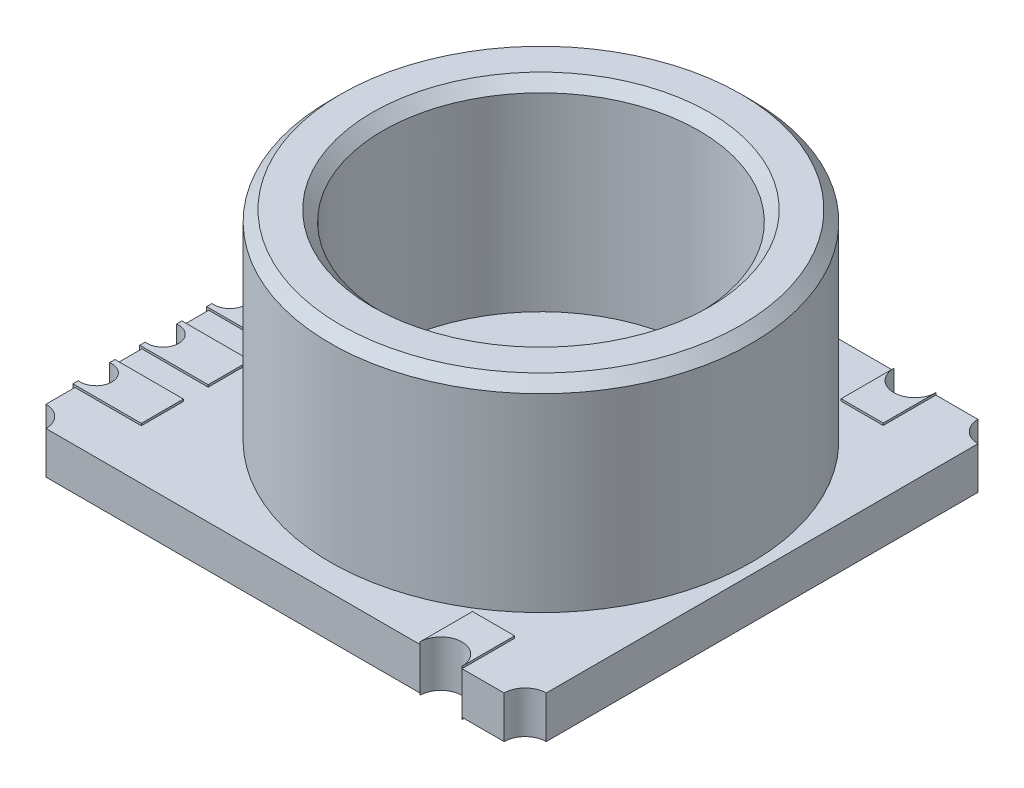
from build123d import *

# Parameters (mm, degrees)
SKETCH_1_W               = 9.5
SKETCH_1_H               = 9
EXTRUDE_1_DEPTH          = 0.8
SKETCH_4_R               = 0.4
CUT_EXTRUDE_1_DEPTH      = 7.59185103
EXTRUDE_2_DEPTH          = 0.04
EXTRUDE_2_DEPTH_BACK     = 0.84
SKETCH_6_W               = 1.3
SKETCH_6_H               = 0.8
SKETCH_6_W_2             = 0.8
SKETCH_6_H_2             = 1
CUT_EXTRUDE_2_DEPTH      = 7.62568487
CUT_EXTRUDE_2_DEPTH_BACK = 7.62568487
SKETCH_5_R               = 0.4
SKETCH_5_R_2             = 0.3
SKETCH_7_R               = 4
SKETCH_7_R_2             = 3
EXTRUDE_3_DEPTH          = 3.8
CHAMFER_1_SIZE           = 0.2
CHAMFER_2_SIZE           = 0.2


with BuildPart() as part:
    # Эскиз1 → Бобышка-Вытянуть1 (new body)
    with BuildSketch(Plane(origin=(0, 0, 0), x_dir=(1, 0, 0), z_dir=(0, 1, 0))):
        Rectangle(SKETCH_1_W, SKETCH_1_H)
    extrude(amount=EXTRUDE_1_DEPTH)

    # Эскиз4 → Вырез-Вытянуть1 (cut, through all)
    with BuildSketch(Plane.XZ):
        with Locations((-4.75, -4.5)):
            Circle(SKETCH_4_R)
        with Locations((4.75, -4.5)):
            Circle(SKETCH_4_R)
        with Locations((-4.75, 4.5)):
            Circle(SKETCH_4_R)
        with Locations((4.75, 4.5)):
            Circle(SKETCH_4_R)
    extrude(amount=-CUT_EXTRUDE_1_DEPTH, mode=Mode.SUBTRACT)

    # Эскиз6 → Бобышка-Вытянуть2 (add, two sides: drawn at the far end of the back side and taken through both)
    with BuildSketch(Plane(origin=(0, 0.8, 0), x_dir=(1, 0, 0), z_dir=(0, 1, 0)).offset(-EXTRUDE_2_DEPTH_BACK)):
        with Locations((-4.14, 3.2)):
            Rectangle(SKETCH_6_W, SKETCH_6_H)
        with Locations((-4.14, 1.93)):
            Rectangle(SKETCH_6_W, SKETCH_6_H)
        with Locations((-4.14, 0.66)):
            Rectangle(SKETCH_6_W, SKETCH_6_H)
        with Locations((-4.14, -0.61)):
            Rectangle(SKETCH_6_W, SKETCH_6_H)
        with Locations((-4.14, -1.88)):
            Rectangle(SKETCH_6_W, SKETCH_6_H)
        with Locations((-4.14, -3.15)):
            Rectangle(SKETCH_6_W, SKETCH_6_H)
        with Locations((3.15, 4)):
            Rectangle(SKETCH_6_W_2, SKETCH_6_H_2)
        with Locations((3.15, -4)):
            Rectangle(SKETCH_6_W_2, SKETCH_6_H_2)
    extrude(amount=EXTRUDE_2_DEPTH + EXTRUDE_2_DEPTH_BACK)

    # Эскиз5 → Вырез-Вытянуть2 (cut, two sides: drawn at the far end of the back side and taken through both)
    with BuildSketch(Plane.XZ.offset(-CUT_EXTRUDE_2_DEPTH_BACK)):
        with Locations((3.15, 4.5)):
            Circle(SKETCH_5_R)
        with Locations((3.15, -4.5)):
            Circle(SKETCH_5_R)
        with Locations((-4.75, -3.2)):
            Circle(SKETCH_5_R_2)
        with Locations((-4.75, -1.93)):
            Circle(SKETCH_5_R_2)
        with Locations((-4.75, -0.66)):
            Circle(SKETCH_5_R_2)
        with Locations((-4.75, 0.61)):
            Circle(SKETCH_5_R_2)
        with Locations((-4.75, 1.88)):
            Circle(SKETCH_5_R_2)
        with Locations((-4.75, 3.15)):
            Circle(SKETCH_5_R_2)
    extrude(amount=CUT_EXTRUDE_2_DEPTH + CUT_EXTRUDE_2_DEPTH_BACK, mode=Mode.SUBTRACT)

    # Эскиз7 → Бобышка-Вытянуть3 (add)
    with BuildSketch(Plane(origin=(0, 0.8, 0), x_dir=(1, 0, 0), z_dir=(0, 1, 0))):
        with Locations(Location((0.55, 0, 0), (0, 0, 90))):
            Circle(SKETCH_7_R)
        with Locations(Location((0.55, 0, 0), (0, 0, 90))):
            Circle(SKETCH_7_R_2, mode=Mode.SUBTRACT)
    extrude(amount=EXTRUDE_3_DEPTH)

    # Фаска1
    chamfer_1_edges = [part.edges().sort_by_distance(p)[0] for p in [
        (0.55, 4.6, 4),
    ]]
    chamfer(chamfer_1_edges, length=CHAMFER_1_SIZE)

    # Фаска2
    chamfer_2_edges = [part.edges().sort_by_distance(p)[0] for p in [
        (0.55, 4.6, 3),
    ]]
    chamfer(chamfer_2_edges, length=CHAMFER_2_SIZE)


solid = part.part
